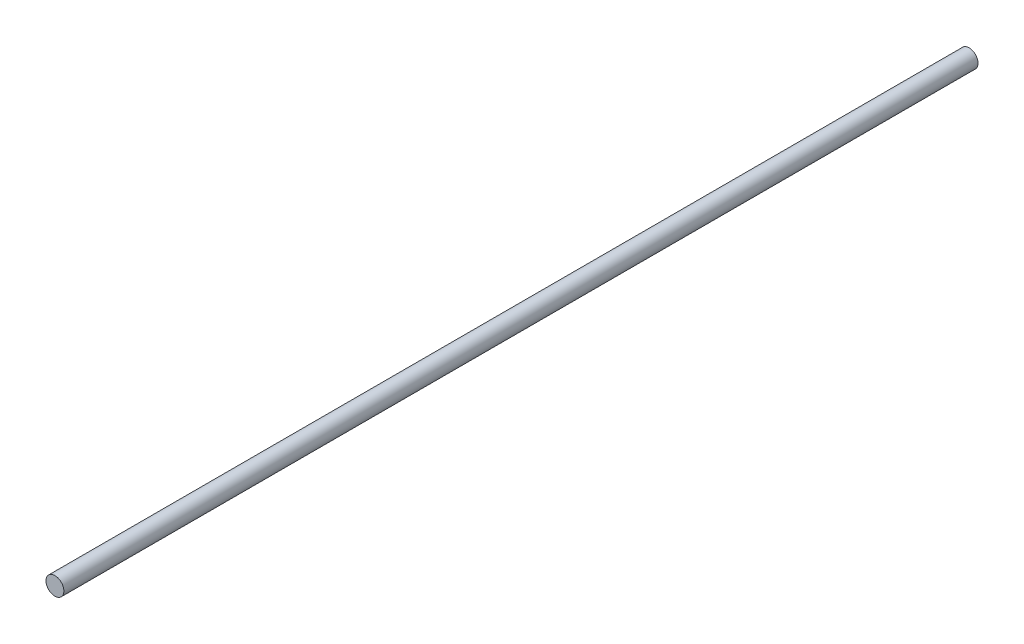
from build123d import *

# Parameters (mm, degrees)
SKETCH_1_R      = 3
EXTRUDE_1_DEPTH = 307


with BuildPart() as part:
    # 草图1 → 凸台-拉伸1 (new body)
    with BuildSketch(Plane.XY):
        Circle(SKETCH_1_R)
    extrude(amount=EXTRUDE_1_DEPTH)


solid = part.part
